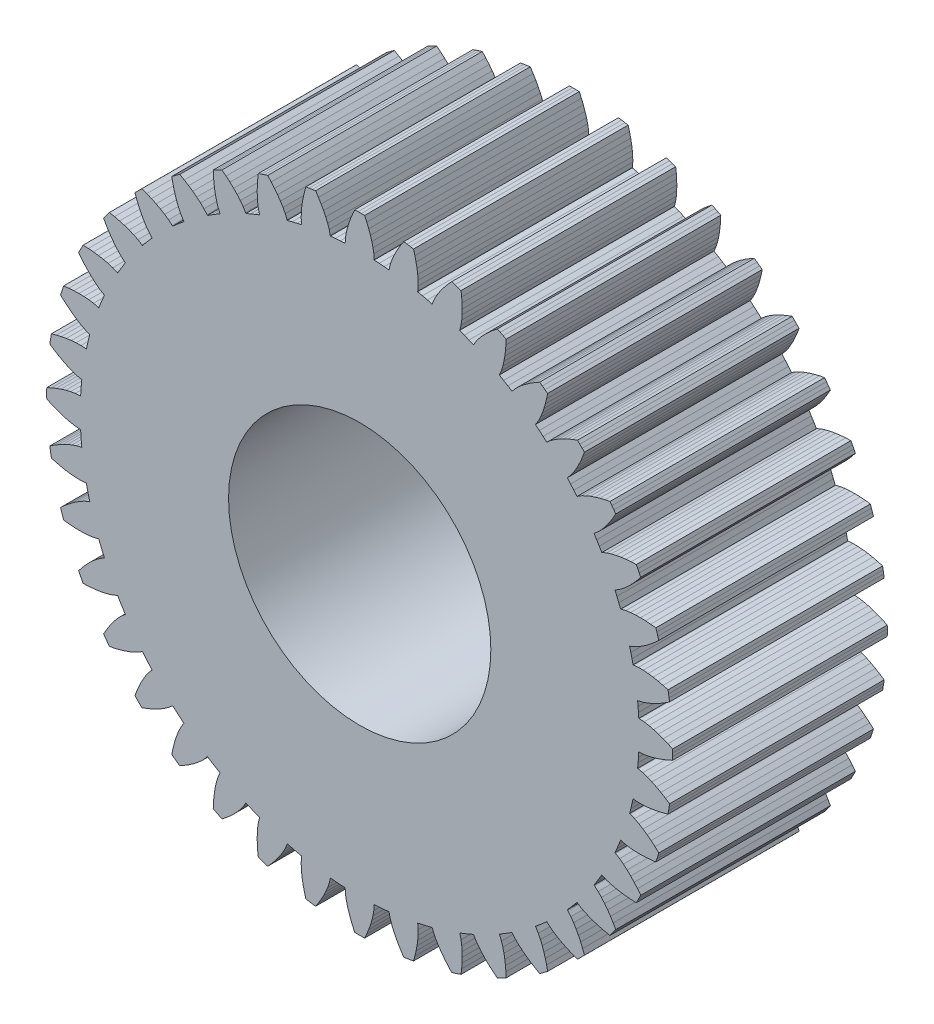
from build123d import *

# Parameters (mm, degrees)
PLANET_TEETH_START = 36
SKETCH_1_R         = 11
PLANET_TEETH_DEPTH = 18


with BuildPart() as part:
    # Эскиз1 → Planet_teeth (new body)
    with BuildSketch(Plane.XY.offset(PLANET_TEETH_START)):
        Polygon((23.406094001, -1.212917913), (23.460836068, -1.21575468), (23.856725851, -1.187664712), (24.254464565, -1.1181649), (24.653070195, -1.020442694), (25.052011856, -0.898946903), (25.450860536, -0.756130069), (25.849230841, -0.593575429), (26.246760326, -0.412398335), (26.24964003, -0.137471139), (26.24964003, 0.137471139), (26.246760326, 0.412398335), (25.849230841, 0.593575429), (25.450860536, 0.756130069), (25.052011856, 0.898946903), (24.653070195, 1.020442694), (24.254464565, 1.1181649), (23.856725851, 1.187664712), (23.460836068, 1.21575468), (23.406094001, 1.212917913), (23.380726111, 1.63035358), (23.347914064, 2.04727016), (23.307668309, 2.463534913), (23.362180178, 2.469296617), (23.748801662, 2.558971557), (24.130771386, 2.689835755), (24.509182398, 2.848710497), (24.884206296, 3.031118698), (25.255803013, 3.2345709), (25.62383957, 3.457443068), (25.988132465, 3.698576884), (25.947968626, 3.970569755), (25.904958178, 4.242127036), (25.85910584, 4.513218937), (25.438128261, 4.629978128), (25.019233407, 4.728212606), (24.60295374, 4.806877448), (24.189917585, 4.864469198), (23.78093233, 4.898632623), (23.377218274, 4.905056735), (22.981808312, 4.870870063), (22.928183979, 4.859504675), (22.837827084, 5.267832603), (22.740198886, 5.674483313), (22.635330469, 6.079327333), (22.688269878, 6.093545636), (23.056103158, 6.242597454), (23.41289853, 6.431603726), (23.76179719, 6.64771898), (24.103668992, 6.886548096), (24.4388638, 7.145625998), (24.767504328, 7.423327842), (25.089590534, 7.718480865), (25.007372119, 7.980842043), (24.922410283, 8.242327688), (24.834714346, 8.502909111), (24.400654538, 8.552375401), (23.971549717, 8.583870856), (23.548089251, 8.596446717), (23.131128921, 8.588716327), (22.721834617, 8.558479754), (22.322085998, 8.501669982), (21.936892163, 8.406048458), (21.885705973, 8.386434304), (21.73258496, 8.775600105), (21.572544541, 9.161971855), (21.40563567, 9.545426538), (21.455699075, 9.567751339), (21.795686875, 9.772509884), (22.11852241, 10.015004268), (22.429317673, 10.28303856), (22.729619361, 10.572407826), (23.020158652, 10.880732069), (23.30131093, 11.206425648), (23.573259615, 11.54833023), (23.451011115, 11.794599514), (23.326189933, 12.039574876), (23.198809763, 12.283229444), (22.762355719, 12.264184807), (22.333606916, 12.228165718), (21.913392653, 12.174342938), (21.502775097, 12.101480755), (21.103249927, 12.007588709), (20.717309883, 11.888943898), (20.351816925, 11.734242043), (20.304329251, 11.706862087), (20.092214468, 12.067283207), (19.873702554, 12.423862243), (19.648863081, 12.776485663), (19.694817753, 12.80636725), (19.998588446, 13.061790687), (20.27951486, 13.351802167), (20.544553917, 13.665155603), (20.795891067, 13.997939787), (21.034620799, 14.347918406), (21.261361925, 14.713584062), (21.47647681, 15.093821379), (21.317208388, 15.3179348), (21.155601372, 15.540367775), (20.991673492, 15.761095901), (20.563572159, 15.674009281), (20.145736592, 15.571362557), (19.739115602, 15.452466431), (19.344951585, 15.316266565), (18.965033185, 15.16103098), (18.602404841, 14.983472559), (18.26561241, 14.773499645), (18.222992557, 14.739028072), (17.957106974, 15.061829748), (17.685504054, 15.37983591), (17.408270271, 15.692945308), (17.448984655, 15.729647898), (17.709058398, 16.029446854), (17.941158351, 16.359834385), (18.15391506, 16.710791163), (18.350098917, 17.078796014), (18.531140771, 17.461811373), (18.697887627, 17.858445206), (18.85087187, 18.267652552), (18.658505243, 18.464091694), (18.464091694, 18.658505243), (18.267652552, 18.85087187), (17.858445206, 18.697887627), (17.461811373, 18.531140771), (17.078796014, 18.350098917), (16.710791163, 18.15391506), (16.359834385, 17.941158351), (16.029446854, 17.709058398), (15.729647898, 17.448984655), (15.692945308, 17.408270271), (15.37983591, 17.685504054), (15.061829748, 17.957106974), (14.739028072, 18.222992557), (14.773499645, 18.26561241), (14.983472559, 18.602404841), (15.16103098, 18.965033185), (15.316266565, 19.344951585), (15.452466431, 19.739115602), (15.571362557, 20.145736592), (15.674009281, 20.563572159), (15.761095901, 20.991673492), (15.540367775, 21.155601372), (15.3179348, 21.317208388), (15.093821379, 21.47647681), (14.713584062, 21.261361925), (14.347918406, 21.034620799), (13.997939787, 20.795891067), (13.665155603, 20.544553917), (13.351802167, 20.27951486), (13.061790687, 19.998588446), (12.80636725, 19.694817753), (12.776485663, 19.648863081), (12.423862243, 19.873702554), (12.067283207, 20.092214468), (11.706862087, 20.304329251), (11.734242043, 20.351816925), (11.888943898, 20.717309883), (12.007588709, 21.103249927), (12.101480755, 21.502775097), (12.174342938, 21.913392653), (12.228165718, 22.333606916), (12.264184807, 22.762355719), (12.283229444, 23.198809763), (12.039574876, 23.326189933), (11.794599514, 23.451011115), (11.54833023, 23.573259615), (11.206425648, 23.30131093), (10.880732069, 23.020158652), (10.572407826, 22.729619361), (10.28303856, 22.429317673), (10.015004268, 22.11852241), (9.772509884, 21.795686875), (9.567751339, 21.455699075), (9.545426538, 21.40563567), (9.161971855, 21.572544541), (8.775600105, 21.73258496), (8.386434304, 21.885705973), (8.406048458, 21.936892163), (8.501669982, 22.322085998), (8.558479754, 22.721834617), (8.588716327, 23.131128921), (8.596446717, 23.548089251), (8.583870856, 23.971549717), (8.552375401, 24.400654538), (8.502909111, 24.834714346), (8.242327688, 24.922410283), (7.980842043, 25.007372119), (7.718480865, 25.089590534), (7.423327842, 24.767504328), (7.145625998, 24.4388638), (6.886548096, 24.103668992), (6.64771898, 23.76179719), (6.431603726, 23.41289853), (6.242597454, 23.056103158), (6.093545636, 22.688269878), (6.079327333, 22.635330469), (5.674483313, 22.740198886), (5.267832603, 22.837827084), (4.859504675, 22.928183979), (4.870870063, 22.981808312), (4.905056735, 23.377218274), (4.898632623, 23.78093233), (4.864469198, 24.189917585), (4.806877448, 24.60295374), (4.728212606, 25.019233407), (4.629978128, 25.438128261), (4.513218937, 25.85910584), (4.242127036, 25.904958178), (3.970569755, 25.947968626), (3.698576884, 25.988132465), (3.457443068, 25.62383957), (3.2345709, 25.255803013), (3.031118698, 24.884206296), (2.848710497, 24.509182398), (2.689835755, 24.130771386), (2.558971557, 23.748801662), (2.469296617, 23.362180178), (2.463534913, 23.307668309), (2.04727016, 23.347914064), (1.63035358, 23.380726111), (1.212917913, 23.406094001), (1.21575468, 23.460836068), (1.187664712, 23.856725851), (1.1181649, 24.254464565), (1.020442694, 24.653070195), (0.898946903, 25.052011856), (0.756130069, 25.450860536), (0.593575429, 25.849230841), (0.412398335, 26.246760326), (0.137471139, 26.24964003), (-0.137471139, 26.24964003), (-0.412398335, 26.246760326), (-0.593575429, 25.849230841), (-0.756130069, 25.450860536), (-0.898946903, 25.052011856), (-1.020442694, 24.653070195), (-1.1181649, 24.254464565), (-1.187664712, 23.856725851), (-1.21575468, 23.460836068), (-1.212917913, 23.406094001), (-1.63035358, 23.380726111), (-2.04727016, 23.347914064), (-2.463534913, 23.307668309), (-2.469296617, 23.362180178), (-2.558971557, 23.748801662), (-2.689835755, 24.130771386), (-2.848710497, 24.509182398), (-3.031118698, 24.884206296), (-3.2345709, 25.255803013), (-3.457443068, 25.62383957), (-3.698576884, 25.988132465), (-3.970569755, 25.947968626), (-4.242127036, 25.904958178), (-4.513218937, 25.85910584), (-4.629978128, 25.438128261), (-4.728212606, 25.019233407), (-4.806877448, 24.60295374), (-4.864469198, 24.189917585), (-4.898632623, 23.78093233), (-4.905056735, 23.377218274), (-4.870870063, 22.981808312), (-4.859504675, 22.928183979), (-5.267832603, 22.837827084), (-5.674483313, 22.740198886), (-6.079327333, 22.635330469), (-6.093545636, 22.688269878), (-6.242597454, 23.056103158), (-6.431603726, 23.41289853), (-6.64771898, 23.76179719), (-6.886548096, 24.103668992), (-7.145625998, 24.4388638), (-7.423327842, 24.767504328), (-7.718480865, 25.089590534), (-7.980842043, 25.007372119), (-8.242327688, 24.922410283), (-8.502909111, 24.834714346), (-8.552375401, 24.400654538), (-8.583870856, 23.971549717), (-8.596446717, 23.548089251), (-8.588716327, 23.131128921), (-8.558479754, 22.721834617), (-8.501669982, 22.322085998), (-8.406048458, 21.936892163), (-8.386434304, 21.885705973), (-8.775600105, 21.73258496), (-9.161971855, 21.572544541), (-9.545426538, 21.40563567), (-9.567751339, 21.455699075), (-9.772509884, 21.795686875), (-10.015004268, 22.11852241), (-10.28303856, 22.429317673), (-10.572407826, 22.729619361), (-10.880732069, 23.020158652), (-11.206425648, 23.30131093), (-11.54833023, 23.573259615), (-11.794599514, 23.451011115), (-12.039574876, 23.326189933), (-12.283229444, 23.198809763), (-12.264184807, 22.762355719), (-12.228165718, 22.333606916), (-12.174342938, 21.913392653), (-12.101480755, 21.502775097), (-12.007588709, 21.103249927), (-11.888943898, 20.717309883), (-11.734242043, 20.351816925), (-11.706862087, 20.304329251), (-12.067283207, 20.092214468), (-12.423862243, 19.873702554), (-12.776485663, 19.648863081), (-12.80636725, 19.694817753), (-13.061790687, 19.998588446), (-13.351802167, 20.27951486), (-13.665155603, 20.544553917), (-13.997939787, 20.795891067), (-14.347918406, 21.034620799), (-14.713584062, 21.261361925), (-15.093821379, 21.47647681), (-15.3179348, 21.317208388), (-15.540367775, 21.155601372), (-15.761095901, 20.991673492), (-15.674009281, 20.563572159), (-15.571362557, 20.145736592), (-15.452466431, 19.739115602), (-15.316266565, 19.344951585), (-15.16103098, 18.965033185), (-14.983472559, 18.602404841), (-14.773499645, 18.26561241), (-14.739028072, 18.222992557), (-15.061829748, 17.957106974), (-15.37983591, 17.685504054), (-15.692945308, 17.408270271), (-15.729647898, 17.448984655), (-16.029446854, 17.709058398), (-16.359834385, 17.941158351), (-16.710791163, 18.15391506), (-17.078796014, 18.350098917), (-17.461811373, 18.531140771), (-17.858445206, 18.697887627), (-18.267652552, 18.85087187), (-18.464091694, 18.658505243), (-18.658505243, 18.464091694), (-18.85087187, 18.267652552), (-18.697887627, 17.858445206), (-18.531140771, 17.461811373), (-18.350098917, 17.078796014), (-18.15391506, 16.710791163), (-17.941158351, 16.359834385), (-17.709058398, 16.029446854), (-17.448984655, 15.729647898), (-17.408270271, 15.692945308), (-17.685504054, 15.37983591), (-17.957106974, 15.061829748), (-18.222992557, 14.739028072), (-18.26561241, 14.773499645), (-18.602404841, 14.983472559), (-18.965033185, 15.16103098), (-19.344951585, 15.316266565), (-19.739115602, 15.452466431), (-20.145736592, 15.571362557), (-20.563572159, 15.674009281), (-20.991673492, 15.761095901), (-21.155601372, 15.540367775), (-21.317208388, 15.3179348), (-21.47647681, 15.093821379), (-21.261361925, 14.713584062), (-21.034620799, 14.347918406), (-20.795891067, 13.997939787), (-20.544553917, 13.665155603), (-20.27951486, 13.351802167), (-19.998588446, 13.061790687), (-19.694817753, 12.80636725), (-19.648863081, 12.776485663), (-19.873702554, 12.423862243), (-20.092214468, 12.067283207), (-20.304329251, 11.706862087), (-20.351816925, 11.734242043), (-20.717309883, 11.888943898), (-21.103249927, 12.007588709), (-21.502775097, 12.101480755), (-21.913392653, 12.174342938), (-22.333606916, 12.228165718), (-22.762355719, 12.264184807), (-23.198809763, 12.283229444), (-23.326189933, 12.039574876), (-23.451011115, 11.794599514), (-23.573259615, 11.54833023), (-23.30131093, 11.206425648), (-23.020158652, 10.880732069), (-22.729619361, 10.572407826), (-22.429317673, 10.28303856), (-22.11852241, 10.015004268), (-21.795686875, 9.772509884), (-21.455699075, 9.567751339), (-21.40563567, 9.545426538), (-21.572544541, 9.161971855), (-21.73258496, 8.775600105), (-21.885705973, 8.386434304), (-21.936892163, 8.406048458), (-22.322085998, 8.501669982), (-22.721834617, 8.558479754), (-23.131128921, 8.588716327), (-23.548089251, 8.596446717), (-23.971549717, 8.583870856), (-24.400654538, 8.552375401), (-24.834714346, 8.502909111), (-24.922410283, 8.242327688), (-25.007372119, 7.980842043), (-25.089590534, 7.718480865), (-24.767504328, 7.423327842), (-24.4388638, 7.145625998), (-24.103668992, 6.886548096), (-23.76179719, 6.64771898), (-23.41289853, 6.431603726), (-23.056103158, 6.242597454), (-22.688269878, 6.093545636), (-22.635330469, 6.079327333), (-22.740198886, 5.674483313), (-22.837827084, 5.267832603), (-22.928183979, 4.859504675), (-22.981808312, 4.870870063), (-23.377218274, 4.905056735), (-23.78093233, 4.898632623), (-24.189917585, 4.864469198), (-24.60295374, 4.806877448), (-25.019233407, 4.728212606), (-25.438128261, 4.629978128), (-25.85910584, 4.513218937), (-25.904958178, 4.242127036), (-25.947968626, 3.970569755), (-25.988132465, 3.698576884), (-25.62383957, 3.457443068), (-25.255803013, 3.2345709), (-24.884206296, 3.031118698), (-24.509182398, 2.848710497), (-24.130771386, 2.689835755), (-23.748801662, 2.558971557), (-23.362180178, 2.469296617), (-23.307668309, 2.463534913), (-23.347914064, 2.04727016), (-23.380726111, 1.63035358), (-23.406094001, 1.212917913), (-23.460836068, 1.21575468), (-23.856725851, 1.187664712), (-24.254464565, 1.1181649), (-24.653070195, 1.020442694), (-25.052011856, 0.898946903), (-25.450860536, 0.756130069), (-25.849230841, 0.593575429), (-26.246760326, 0.412398335), (-26.24964003, 0.137471139), (-26.24964003, -0.137471139), (-26.246760326, -0.412398335), (-25.849230841, -0.593575429), (-25.450860536, -0.756130069), (-25.052011856, -0.898946903), (-24.653070195, -1.020442694), (-24.254464565, -1.1181649), (-23.856725851, -1.187664712), (-23.460836068, -1.21575468), (-23.406094001, -1.212917913), (-23.380726111, -1.63035358), (-23.347914064, -2.04727016), (-23.307668309, -2.463534913), (-23.362180178, -2.469296617), (-23.748801662, -2.558971557), (-24.130771386, -2.689835755), (-24.509182398, -2.848710497), (-24.884206296, -3.031118698), (-25.255803013, -3.2345709), (-25.62383957, -3.457443068), (-25.988132465, -3.698576884), (-25.947968626, -3.970569755), (-25.904958178, -4.242127036), (-25.85910584, -4.513218937), (-25.438128261, -4.629978128), (-25.019233407, -4.728212606), (-24.60295374, -4.806877448), (-24.189917585, -4.864469198), (-23.78093233, -4.898632623), (-23.377218274, -4.905056735), (-22.981808312, -4.870870063), (-22.928183979, -4.859504675), (-22.837827084, -5.267832603), (-22.740198886, -5.674483313), (-22.635330469, -6.079327333), (-22.688269878, -6.093545636), (-23.056103158, -6.242597454), (-23.41289853, -6.431603726), (-23.76179719, -6.64771898), (-24.103668992, -6.886548096), (-24.4388638, -7.145625998), (-24.767504328, -7.423327842), (-25.089590534, -7.718480865), (-25.007372119, -7.980842043), (-24.922410283, -8.242327688), (-24.834714346, -8.502909111), (-24.400654538, -8.552375401), (-23.971549717, -8.583870856), (-23.548089251, -8.596446717), (-23.131128921, -8.588716327), (-22.721834617, -8.558479754), (-22.322085998, -8.501669982), (-21.936892163, -8.406048458), (-21.885705973, -8.386434304), (-21.73258496, -8.775600105), (-21.572544541, -9.161971855), (-21.40563567, -9.545426538), (-21.455699075, -9.567751339), (-21.795686875, -9.772509884), (-22.11852241, -10.015004268), (-22.429317673, -10.28303856), (-22.729619361, -10.572407826), (-23.020158652, -10.880732069), (-23.30131093, -11.206425648), (-23.573259615, -11.54833023), (-23.451011115, -11.794599514), (-23.326189933, -12.039574876), (-23.198809763, -12.283229444), (-22.762355719, -12.264184807), (-22.333606916, -12.228165718), (-21.913392653, -12.174342938), (-21.502775097, -12.101480755), (-21.103249927, -12.007588709), (-20.717309883, -11.888943898), (-20.351816925, -11.734242043), (-20.304329251, -11.706862087), (-20.092214468, -12.067283207), (-19.873702554, -12.423862243), (-19.648863081, -12.776485663), (-19.694817753, -12.80636725), (-19.998588446, -13.061790687), (-20.27951486, -13.351802167), (-20.544553917, -13.665155603), (-20.795891067, -13.997939787), (-21.034620799, -14.347918406), (-21.261361925, -14.713584062), (-21.47647681, -15.093821379), (-21.317208388, -15.3179348), (-21.155601372, -15.540367775), (-20.991673492, -15.761095901), (-20.563572159, -15.674009281), (-20.145736592, -15.571362557), (-19.739115602, -15.452466431), (-19.344951585, -15.316266565), (-18.965033185, -15.16103098), (-18.602404841, -14.983472559), (-18.26561241, -14.773499645), (-18.222992557, -14.739028072), (-17.957106974, -15.061829748), (-17.685504054, -15.37983591), (-17.408270271, -15.692945308), (-17.448984655, -15.729647898), (-17.709058398, -16.029446854), (-17.941158351, -16.359834385), (-18.15391506, -16.710791163), (-18.350098917, -17.078796014), (-18.531140771, -17.461811373), (-18.697887627, -17.858445206), (-18.85087187, -18.267652552), (-18.658505243, -18.464091694), (-18.464091694, -18.658505243), (-18.267652552, -18.85087187), (-17.858445206, -18.697887627), (-17.461811373, -18.531140771), (-17.078796014, -18.350098917), (-16.710791163, -18.15391506), (-16.359834385, -17.941158351), (-16.029446854, -17.709058398), (-15.729647898, -17.448984655), (-15.692945308, -17.408270271), (-15.37983591, -17.685504054), (-15.061829748, -17.957106974), (-14.739028072, -18.222992557), (-14.773499645, -18.26561241), (-14.983472559, -18.602404841), (-15.16103098, -18.965033185), (-15.316266565, -19.344951585), (-15.452466431, -19.739115602), (-15.571362557, -20.145736592), (-15.674009281, -20.563572159), (-15.761095901, -20.991673492), (-15.540367775, -21.155601372), (-15.3179348, -21.317208388), (-15.093821379, -21.47647681), (-14.713584062, -21.261361925), (-14.347918406, -21.034620799), (-13.997939787, -20.795891067), (-13.665155603, -20.544553917), (-13.351802167, -20.27951486), (-13.061790687, -19.998588446), (-12.80636725, -19.694817753), (-12.776485663, -19.648863081), (-12.423862243, -19.873702554), (-12.067283207, -20.092214468), (-11.706862087, -20.304329251), (-11.734242043, -20.351816925), (-11.888943898, -20.717309883), (-12.007588709, -21.103249927), (-12.101480755, -21.502775097), (-12.174342938, -21.913392653), (-12.228165718, -22.333606916), (-12.264184807, -22.762355719), (-12.283229444, -23.198809763), (-12.039574876, -23.326189933), (-11.794599514, -23.451011115), (-11.54833023, -23.573259615), (-11.206425648, -23.30131093), (-10.880732069, -23.020158652), (-10.572407826, -22.729619361), (-10.28303856, -22.429317673), (-10.015004268, -22.11852241), (-9.772509884, -21.795686875), (-9.567751339, -21.455699075), (-9.545426538, -21.40563567), (-9.161971855, -21.572544541), (-8.775600105, -21.73258496), (-8.386434304, -21.885705973), (-8.406048458, -21.936892163), (-8.501669982, -22.322085998), (-8.558479754, -22.721834617), (-8.588716327, -23.131128921), (-8.596446717, -23.548089251), (-8.583870856, -23.971549717), (-8.552375401, -24.400654538), (-8.502909111, -24.834714346), (-8.242327688, -24.922410283), (-7.980842043, -25.007372119), (-7.718480865, -25.089590534), (-7.423327842, -24.767504328), (-7.145625998, -24.4388638), (-6.886548096, -24.103668992), (-6.64771898, -23.76179719), (-6.431603726, -23.41289853), (-6.242597454, -23.056103158), (-6.093545636, -22.688269878), (-6.079327333, -22.635330469), (-5.674483313, -22.740198886), (-5.267832603, -22.837827084), (-4.859504675, -22.928183979), (-4.870870063, -22.981808312), (-4.905056735, -23.377218274), (-4.898632623, -23.78093233), (-4.864469198, -24.189917585), (-4.806877448, -24.60295374), (-4.728212606, -25.019233407), (-4.629978128, -25.438128261), (-4.513218937, -25.85910584), (-4.242127036, -25.904958178), (-3.970569755, -25.947968626), (-3.698576884, -25.988132465), (-3.457443068, -25.62383957), (-3.2345709, -25.255803013), (-3.031118698, -24.884206296), (-2.848710497, -24.509182398), (-2.689835755, -24.130771386), (-2.558971557, -23.748801662), (-2.469296617, -23.362180178), (-2.463534913, -23.307668309), (-2.04727016, -23.347914064), (-1.63035358, -23.380726111), (-1.212917913, -23.406094001), (-1.21575468, -23.460836068), (-1.187664712, -23.856725851), (-1.1181649, -24.254464565), (-1.020442694, -24.653070195), (-0.898946903, -25.052011856), (-0.756130069, -25.450860536), (-0.593575429, -25.849230841), (-0.412398335, -26.246760326), (-0.137471139, -26.24964003), (0.137471139, -26.24964003), (0.412398335, -26.246760326), (0.593575429, -25.849230841), (0.756130069, -25.450860536), (0.898946903, -25.052011856), (1.020442694, -24.653070195), (1.1181649, -24.254464565), (1.187664712, -23.856725851), (1.21575468, -23.460836068), (1.212917913, -23.406094001), (1.63035358, -23.380726111), (2.04727016, -23.347914064), (2.463534913, -23.307668309), (2.469296617, -23.362180178), (2.558971557, -23.748801662), (2.689835755, -24.130771386), (2.848710497, -24.509182398), (3.031118698, -24.884206296), (3.2345709, -25.255803013), (3.457443068, -25.62383957), (3.698576884, -25.988132465), (3.970569755, -25.947968626), (4.242127036, -25.904958178), (4.513218937, -25.85910584), (4.629978128, -25.438128261), (4.728212606, -25.019233407), (4.806877448, -24.60295374), (4.864469198, -24.189917585), (4.898632623, -23.78093233), (4.905056735, -23.377218274), (4.870870063, -22.981808312), (4.859504675, -22.928183979), (5.267832603, -22.837827084), (5.674483313, -22.740198886), (6.079327333, -22.635330469), (6.093545636, -22.688269878), (6.242597454, -23.056103158), (6.431603726, -23.41289853), (6.64771898, -23.76179719), (6.886548096, -24.103668992), (7.145625998, -24.4388638), (7.423327842, -24.767504328), (7.718480865, -25.089590534), (7.980842043, -25.007372119), (8.242327688, -24.922410283), (8.502909111, -24.834714346), (8.552375401, -24.400654538), (8.583870856, -23.971549717), (8.596446717, -23.548089251), (8.588716327, -23.131128921), (8.558479754, -22.721834617), (8.501669982, -22.322085998), (8.406048458, -21.936892163), (8.386434304, -21.885705973), (8.775600105, -21.73258496), (9.161971855, -21.572544541), (9.545426538, -21.40563567), (9.567751339, -21.455699075), (9.772509884, -21.795686875), (10.015004268, -22.11852241), (10.28303856, -22.429317673), (10.572407826, -22.729619361), (10.880732069, -23.020158652), (11.206425648, -23.30131093), (11.54833023, -23.573259615), (11.794599514, -23.451011115), (12.039574876, -23.326189933), (12.283229444, -23.198809763), (12.264184807, -22.762355719), (12.228165718, -22.333606916), (12.174342938, -21.913392653), (12.101480755, -21.502775097), (12.007588709, -21.103249927), (11.888943898, -20.717309883), (11.734242043, -20.351816925), (11.706862087, -20.304329251), (12.067283207, -20.092214468), (12.423862243, -19.873702554), (12.776485663, -19.648863081), (12.80636725, -19.694817753), (13.061790687, -19.998588446), (13.351802167, -20.27951486), (13.665155603, -20.544553917), (13.997939787, -20.795891067), (14.347918406, -21.034620799), (14.713584062, -21.261361925), (15.093821379, -21.47647681), (15.3179348, -21.317208388), (15.540367775, -21.155601372), (15.761095901, -20.991673492), (15.674009281, -20.563572159), (15.571362557, -20.145736592), (15.452466431, -19.739115602), (15.316266565, -19.344951585), (15.16103098, -18.965033185), (14.983472559, -18.602404841), (14.773499645, -18.26561241), (14.739028072, -18.222992557), (15.061829748, -17.957106974), (15.37983591, -17.685504054), (15.692945308, -17.408270271), (15.729647898, -17.448984655), (16.029446854, -17.709058398), (16.359834385, -17.941158351), (16.710791163, -18.15391506), (17.078796014, -18.350098917), (17.461811373, -18.531140771), (17.858445206, -18.697887627), (18.267652552, -18.85087187), (18.464091694, -18.658505243), (18.658505243, -18.464091694), (18.85087187, -18.267652552), (18.697887627, -17.858445206), (18.531140771, -17.461811373), (18.350098917, -17.078796014), (18.15391506, -16.710791163), (17.941158351, -16.359834385), (17.709058398, -16.029446854), (17.448984655, -15.729647898), (17.408270271, -15.692945308), (17.685504054, -15.37983591), (17.957106974, -15.061829748), (18.222992557, -14.739028072), (18.26561241, -14.773499645), (18.602404841, -14.983472559), (18.965033185, -15.16103098), (19.344951585, -15.316266565), (19.739115602, -15.452466431), (20.145736592, -15.571362557), (20.563572159, -15.674009281), (20.991673492, -15.761095901), (21.155601372, -15.540367775), (21.317208388, -15.3179348), (21.47647681, -15.093821379), (21.261361925, -14.713584062), (21.034620799, -14.347918406), (20.795891067, -13.997939787), (20.544553917, -13.665155603), (20.27951486, -13.351802167), (19.998588446, -13.061790687), (19.694817753, -12.80636725), (19.648863081, -12.776485663), (19.873702554, -12.423862243), (20.092214468, -12.067283207), (20.304329251, -11.706862087), (20.351816925, -11.734242043), (20.717309883, -11.888943898), (21.103249927, -12.007588709), (21.502775097, -12.101480755), (21.913392653, -12.174342938), (22.333606916, -12.228165718), (22.762355719, -12.264184807), (23.198809763, -12.283229444), (23.326189933, -12.039574876), (23.451011115, -11.794599514), (23.573259615, -11.54833023), (23.30131093, -11.206425648), (23.020158652, -10.880732069), (22.729619361, -10.572407826), (22.429317673, -10.28303856), (22.11852241, -10.015004268), (21.795686875, -9.772509884), (21.455699075, -9.567751339), (21.40563567, -9.545426538), (21.572544541, -9.161971855), (21.73258496, -8.775600105), (21.885705973, -8.386434304), (21.936892163, -8.406048458), (22.322085998, -8.501669982), (22.721834617, -8.558479754), (23.131128921, -8.588716327), (23.548089251, -8.596446717), (23.971549717, -8.583870856), (24.400654538, -8.552375401), (24.834714346, -8.502909111), (24.922410283, -8.242327688), (25.007372119, -7.980842043), (25.089590534, -7.718480865), (24.767504328, -7.423327842), (24.4388638, -7.145625998), (24.103668992, -6.886548096), (23.76179719, -6.64771898), (23.41289853, -6.431603726), (23.056103158, -6.242597454), (22.688269878, -6.093545636), (22.635330469, -6.079327333), (22.740198886, -5.674483313), (22.837827084, -5.267832603), (22.928183979, -4.859504675), (22.981808312, -4.870870063), (23.377218274, -4.905056735), (23.78093233, -4.898632623), (24.189917585, -4.864469198), (24.60295374, -4.806877448), (25.019233407, -4.728212606), (25.438128261, -4.629978128), (25.85910584, -4.513218937), (25.904958178, -4.242127036), (25.947968626, -3.970569755), (25.988132465, -3.698576884), (25.62383957, -3.457443068), (25.255803013, -3.2345709), (24.884206296, -3.031118698), (24.509182398, -2.848710497), (24.130771386, -2.689835755), (23.748801662, -2.558971557), (23.362180178, -2.469296617), (23.307668309, -2.463534913), (23.347914064, -2.04727016), (23.380726111, -1.63035358), align=None)
        Circle(SKETCH_1_R, mode=Mode.SUBTRACT)
    extrude(amount=PLANET_TEETH_DEPTH)


solid = part.part
